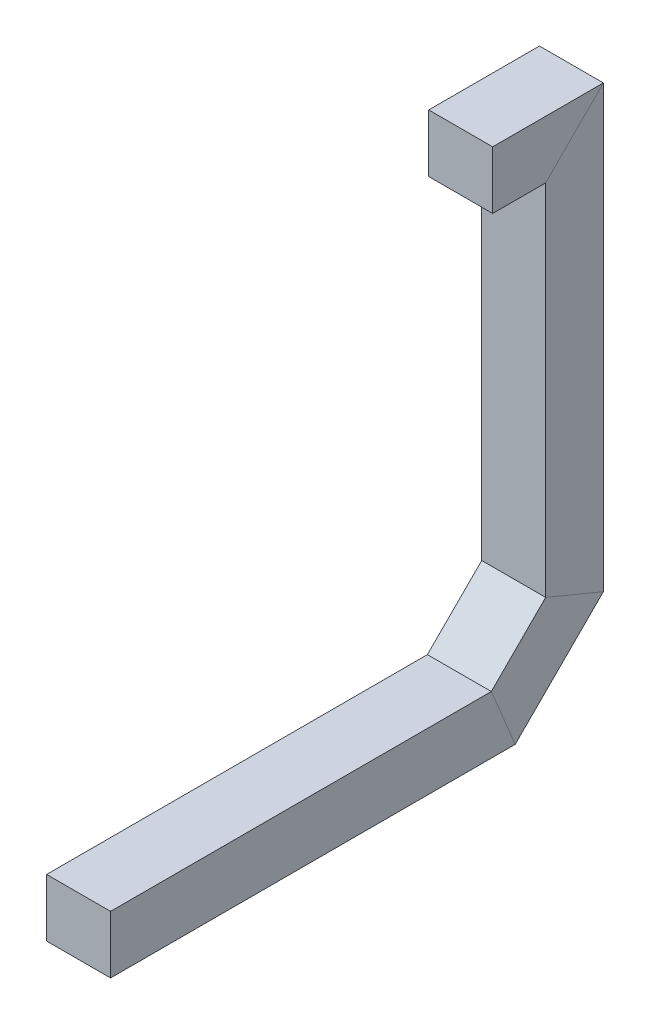
from build123d import *

# Parameters (mm, degrees)
SKETCH2_W = 388.813364174
SKETCH2_H = 351.081799862


with BuildPart() as part:
    # Sweep1: sweep along a path in Sketch1
    with BuildLine(Plane(origin=(0, 0, 0), x_dir=(0, 0, -1), z_dir=(1, 0, 0))) as sweep1_path:
        Line((-2387.6, 0), (0, 0))
        Line((0, 0), (431.8, 431.8))
        Line((431.8, 431.8), (431.8, 2860.04))
        Line((431.8, 2860.04), (-63.5, 2860.04))
    # Sketch2 → Sweep1 (sweep)
    with BuildSketch(Plane.XY):
        with Locations((0, 2862.58)):
            Rectangle(SKETCH2_W, SKETCH2_H)
    sweep(path=sweep1_path.line, transition=Transition.RIGHT)


solid = part.part
